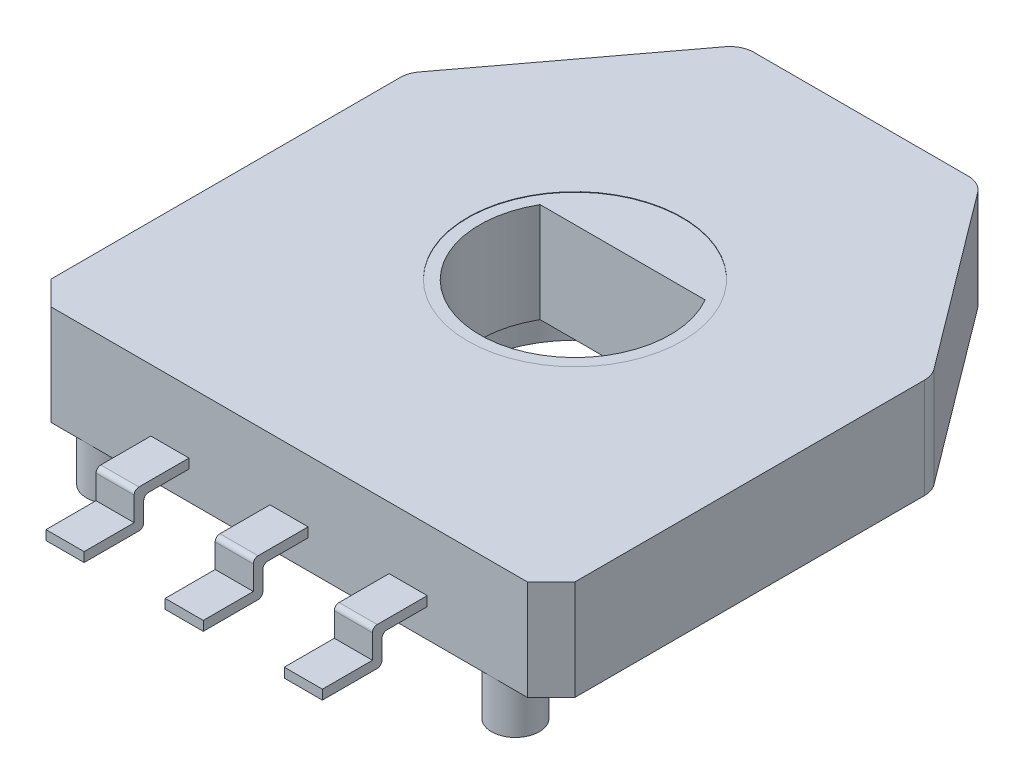
from build123d import *

# Parameters (mm, degrees)
SKETCH1_R                = 2.5
FORMABASE_DEPTH          = 2.1
FILLET1_R                = 0.5
BOSS_EXTRUDE2_DEPTH      = 2.9
BOSS_EXTRUDE2_DEPTH_BACK = 2.9
BOSS_EXTRUDE2_START      = -5.5
SKETCH3_W                = 1.7
SKETCH3_H                = 2.2
CUT_EXTRUDE1_DEPTH       = 11.094552987
SKETCH4_R                = 2.5
SKETCH4_R_2              = 2.25
SKETCH4_R_3              = 0.5
BOSS_EXTRUDE3_DEPTH      = 0.6
SKETCH5_R                = 0.5
BOSS_EXTRUDE4_DEPTH      = 0.4
SKETCH6_R                = 2.25
CUT_EXTRUDE2_DEPTH       = 0.01


with BuildPart() as part:
    # Sketch1 → FormaBase (new body)
    # profile 1 of 2: a face of its own
    with BuildSketch(Plane(origin=(0, 0, 0), x_dir=(1, 0, 0), z_dir=(0, 1, 0))):
        Polygon((-5, -6), (5, -6), (5.5, -5.5), (5.5, 2), (2.5, 6), (-2.5, 6), (-5.5, 2), (-5.5, -5.5), align=None)
        Circle(SKETCH1_R, mode=Mode.SUBTRACT)
    # profile 2 of 2: a face of its own
    with BuildSketch(Plane(origin=(0, 0, 0), x_dir=(1, 0, 0), z_dir=(0, 1, 0))):
        Circle(SKETCH1_R)
        with BuildLine():
            ThreePointArc((-1.732050808, 1), (0, -2), (1.732050808, 1))
            Line((1.732050808, 1), (-1.732050808, 1))
        make_face(mode=Mode.SUBTRACT)
    extrude(amount=FORMABASE_DEPTH)

    # Fillet1
    fillet1_edges = [part.edges().sort_by_distance(p)[0] for p in [
        (-5.5, 1.05, -2),
        (-2.5, 1.05, -6),
        (2.5, 1.05, -6),
        (5.5, 1.05, -2),
    ]]
    fillet(fillet1_edges, radius=FILLET1_R)

    # Sketch2 → Boss-Extrude2 (add, two sides: drawn at the far end of the back side and taken through both)
    with BuildSketch(Plane(origin=(5.5, 0, 0), x_dir=(0, 0, -1), z_dir=(1, 0, 0)).offset(BOSS_EXTRUDE2_START - BOSS_EXTRUDE2_DEPTH_BACK)):
        with BuildLine():
            Line((-8.2, 0), (-7.05, 0))
            ThreePointArc((-7.05, 0), (-6.979289322, 0.029289322), (-6.95, 0.1))
            Line((-6.95, 0.1), (-6.95, 0.5))
            ThreePointArc((-6.95, 0.5), (-6.920710678, 0.570710678), (-6.85, 0.6))
            Line((-6.85, 0.6), (-6, 0.6))
            Line((-6, 0.6), (-6, 0.8))
            Line((-6, 0.8), (-7.05, 0.8))
            ThreePointArc((-7.05, 0.8), (-7.120710678, 0.770710678), (-7.15, 0.7))
            Line((-7.15, 0.7), (-7.15, 0.2))
            Line((-7.15, 0.2), (-8.2, 0.2))
            Line((-8.2, 0.2), (-8.2, 0))
        make_face()
        Polygon((6, 0.8), (6, 0), (6.7, 0), (6.7, 0.2), (6.1, 0.2), (6.1, 0.8), align=None)
    extrude(amount=BOSS_EXTRUDE2_DEPTH + BOSS_EXTRUDE2_DEPTH_BACK)

    # Sketch3 → Cut-Extrude1 (cut, through all)
    with BuildSketch(Plane(origin=(0, 2.1, 0), x_dir=(1, 0, 0), z_dir=(0, 1, 0))):
        with Locations((-1.25, -7.1)):
            Rectangle(SKETCH3_W, SKETCH3_H)
        with Locations((1.25, -7.1)):
            Rectangle(SKETCH3_W, SKETCH3_H)
        Polygon((-2.1, 6), (-0.4, 6), (-0.4, 6.7), (-2.9, 6.7), (-2.9, 6), (-2.25, 6), align=None)
        Polygon((0.4, 6.7), (0.4, 6), (2.1, 6), (2.25, 6), (2.9, 6), (2.9, 6.7), align=None)
    extrude(amount=-CUT_EXTRUDE1_DEPTH, mode=Mode.SUBTRACT)

    # Sketch4 → Boss-Extrude3 (add)
    # profile 1 of 3: a face of its own
    with BuildSketch(Plane.XZ):
        with Locations(Location((0, 0, 0), (0, 0, 90))):
            Circle(SKETCH4_R)
        with Locations(Location((0, 0, 0), (0, 0, 270))):
            Circle(SKETCH4_R_2, mode=Mode.SUBTRACT)
    # profile 2 of 3: a face of its own
    with BuildSketch(Plane.XZ):
        with Locations(Location((4.25, 5.5, 0), (0, 0, 90))):
            Circle(SKETCH4_R_3)
    # profile 3 of 3: a face of its own
    with BuildSketch(Plane.XZ):
        with Locations(Location((-4.25, 5.5, 0), (0, 0, 90))):
            Circle(SKETCH4_R_3)
    extrude(amount=BOSS_EXTRUDE3_DEPTH)

    # Sketch5 → Boss-Extrude4 (add)
    with BuildSketch(Plane.XZ.offset(0.6)):
        with Locations(Location((-4.25, 5.5, 0), (0, 0, 90))):
            Circle(SKETCH5_R)
        with Locations(Location((4.25, 5.5, 0), (0, 0, 90))):
            Circle(SKETCH5_R)
    extrude(amount=BOSS_EXTRUDE4_DEPTH)

    # Sketch6 → Cut-Extrude2 (cut)
    with BuildSketch(Plane(origin=(0, 2.1, 0), x_dir=(1, 0, 0), z_dir=(0, 1, 0))):
        with Locations(Location((0, 0, 0), (0, 0, 90))):
            Circle(SKETCH6_R)
    extrude(amount=-CUT_EXTRUDE2_DEPTH, mode=Mode.SUBTRACT)


solid = part.part
